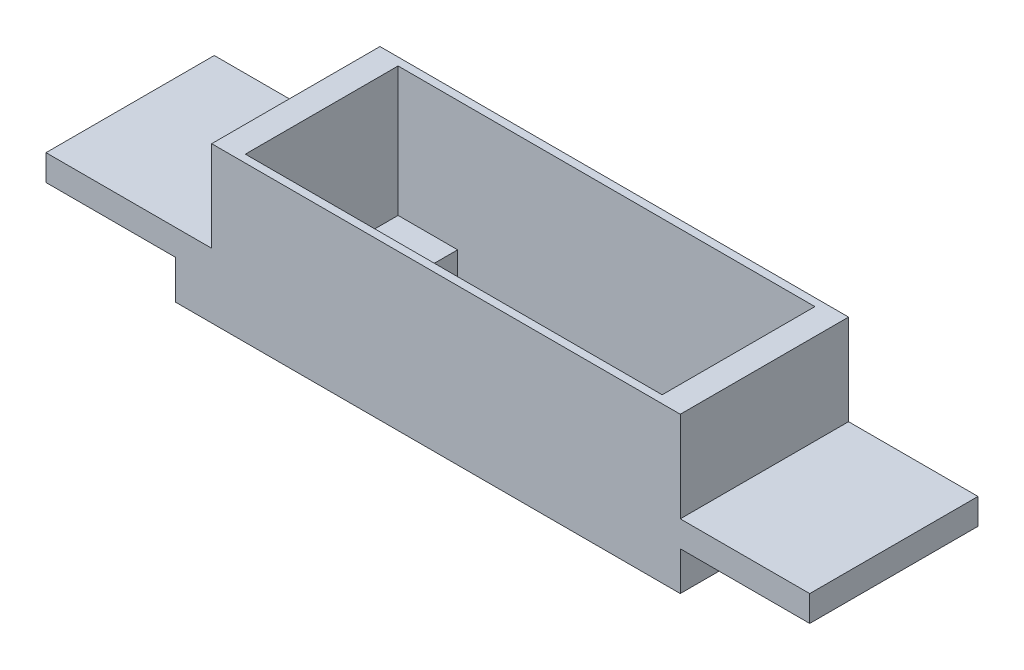
from build123d import *

# Parameters (mm, degrees)
SKETCH1_W           = 39
SKETCH1_H           = 13
BOSS_EXTRUDE1_DEPTH = 2
SKETCH3_W           = 2
SKETCH3_H           = 13
SKETCH3_W_2         = 4.8
BOSS_EXTRUDE2_DEPTH = 1
SKETCH4_W           = 14.8
SKETCH4_H           = 13
SKETCH4_W_2         = 12
BOSS_EXTRUDE3_DEPTH = 2
SKETCH5_W           = 23
SKETCH5_H           = 11.8
CUT_EXTRUDE1_DEPTH  = 31.356218473
SKETCH6_R           = 1
BOSS_EXTRUDE4_DEPTH = 3
SKETCH7_W           = 32.2
SKETCH7_H           = 0.6
BOSS_EXTRUDE5_DEPTH = 10
SKETCH8_W           = 2
SKETCH8_H           = 13
BOSS_EXTRUDE6_DEPTH = 7


with BuildPart() as part:
    # Sketch1 → Boss-Extrude1 (new body)
    with BuildSketch(Plane(origin=(0, 0, 0), x_dir=(1, 0, 0), z_dir=(0, 1, 0))):
        Rectangle(SKETCH1_W, SKETCH1_H)
    extrude(amount=BOSS_EXTRUDE1_DEPTH)

    # Sketch3 → Boss-Extrude2 (add)
    with BuildSketch(Plane(origin=(0, 2, 0), x_dir=(1, 0, 0), z_dir=(0, 1, 0))):
        with Locations((18.5, 0)):
            Rectangle(SKETCH3_W, SKETCH3_H)
        with Locations((-17.1, 0)):
            Rectangle(SKETCH3_W_2, SKETCH3_H)
    extrude(amount=BOSS_EXTRUDE2_DEPTH)

    # Sketch4 → Boss-Extrude3 (add)
    with BuildSketch(Plane(origin=(0, 3, 0), x_dir=(1, 0, 0), z_dir=(0, 1, 0))):
        with Locations((-22.1, 0)):
            Rectangle(SKETCH4_W, SKETCH4_H)
        with Locations((23.5, 0)):
            Rectangle(SKETCH4_W_2, SKETCH4_H)
    extrude(amount=BOSS_EXTRUDE3_DEPTH)

    # Sketch5 → Cut-Extrude1 (cut, through all)
    with BuildSketch(Plane(origin=(0, 2, 0), x_dir=(1, 0, 0), z_dir=(0, 1, 0))):
        with Locations((1.4, 0)):
            Rectangle(SKETCH5_W, SKETCH5_H)
    extrude(amount=-CUT_EXTRUDE1_DEPTH, mode=Mode.SUBTRACT)

    # Sketch6 → Boss-Extrude4 (add)
    with BuildSketch(Plane(origin=(0, 2, 0), x_dir=(1, 0, 0), z_dir=(0, 1, 0))):
        with Locations(Location((-12.4, 0, 0), (0, 0, 270))):
            Circle(SKETCH6_R)
        with Locations(Location((15.2, 0, 0), (0, 0, 270))):
            Circle(SKETCH6_R)
    extrude(amount=BOSS_EXTRUDE4_DEPTH)

    # Sketch7 → Boss-Extrude5 (add)
    with BuildSketch(Plane(origin=(0, 2, 0), x_dir=(1, 0, 0), z_dir=(0, 1, 0))):
        with Locations((1.4, -6.2)):
            Rectangle(SKETCH7_W, SKETCH7_H)
        with Locations((1.4, 6.2)):
            Rectangle(SKETCH7_W, SKETCH7_H)
    extrude(amount=BOSS_EXTRUDE5_DEPTH)

    # Sketch8 → Boss-Extrude6 (add)
    with BuildSketch(Plane(origin=(0, 5, 0), x_dir=(1, 0, 0), z_dir=(0, 1, 0))):
        with Locations((-15.7, 0)):
            Rectangle(SKETCH8_W, SKETCH8_H)
        with Locations((18.5, 0)):
            Rectangle(SKETCH8_W, SKETCH8_H)
    extrude(amount=BOSS_EXTRUDE6_DEPTH)


solid = part.part
